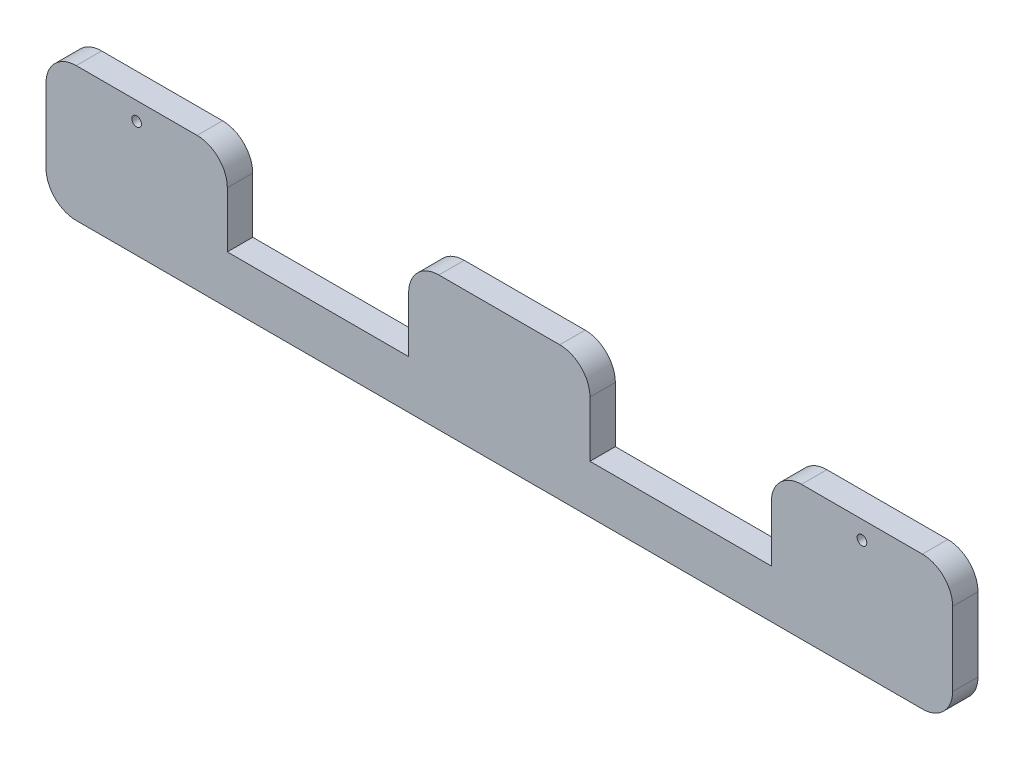
from build123d import *

# Parameters (mm, degrees)
SKETCH1_W           = 190.5
SKETCH1_H           = 28.194
BOSS_EXTRUDE1_DEPTH = 5.334
SKETCH3_W           = 38.1
SKETCH3_H           = 18.034
CUT_EXTRUDE1_DEPTH  = 122.162721385
SKETCH4_R           = 1.016
CUT_EXTRUDE2_DEPTH  = 122.162721385
FILLET1_R           = 6.35


with BuildPart() as part:
    # Sketch1 → Boss-Extrude1 (new body)
    with BuildSketch(Plane.XY):
        with Locations((10.187554582, -45.357819662)):
            Rectangle(SKETCH1_W, SKETCH1_H)
    extrude(amount=BOSS_EXTRUDE1_DEPTH)

    # Sketch3 → Cut-Extrude1 (cut, through all)
    with BuildSketch(Plane.XY.offset(5.334)):
        with Locations((-27.912445418, -40.277819662)):
            Rectangle(SKETCH3_W, SKETCH3_H)
        with Locations((48.287554582, -40.277819662)):
            Rectangle(SKETCH3_W, SKETCH3_H)
    extrude(amount=-CUT_EXTRUDE1_DEPTH, mode=Mode.SUBTRACT)

    # Sketch4 → Cut-Extrude2 (cut, through all)
    with BuildSketch(Plane.XY.offset(5.334)):
        with Locations((-66.012445418, -35.070819662)):
            Circle(SKETCH4_R)
        with Locations(Location((86.387554582, -35.070819662, 0), (0, 0, 180))):
            Circle(SKETCH4_R)
    extrude(amount=-CUT_EXTRUDE2_DEPTH, mode=Mode.SUBTRACT)

    # Fillet1
    fillet1_edges = [part.edges().sort_by_distance(p)[0] for p in [
        (-46.962445418, -31.260819662, 2.667),
        (-8.862445418, -31.260819662, 2.667),
        (29.237554582, -31.260819662, 2.667),
        (67.337554582, -31.260819662, 2.667),
        (-85.062445418, -31.260819662, 2.667),
        (105.437554582, -31.260819662, 2.667),
        (105.437554582, -59.454819662, 2.667),
        (-85.062445418, -59.454819662, 2.667),
    ]]
    fillet(fillet1_edges, radius=FILLET1_R)


solid = part.part
